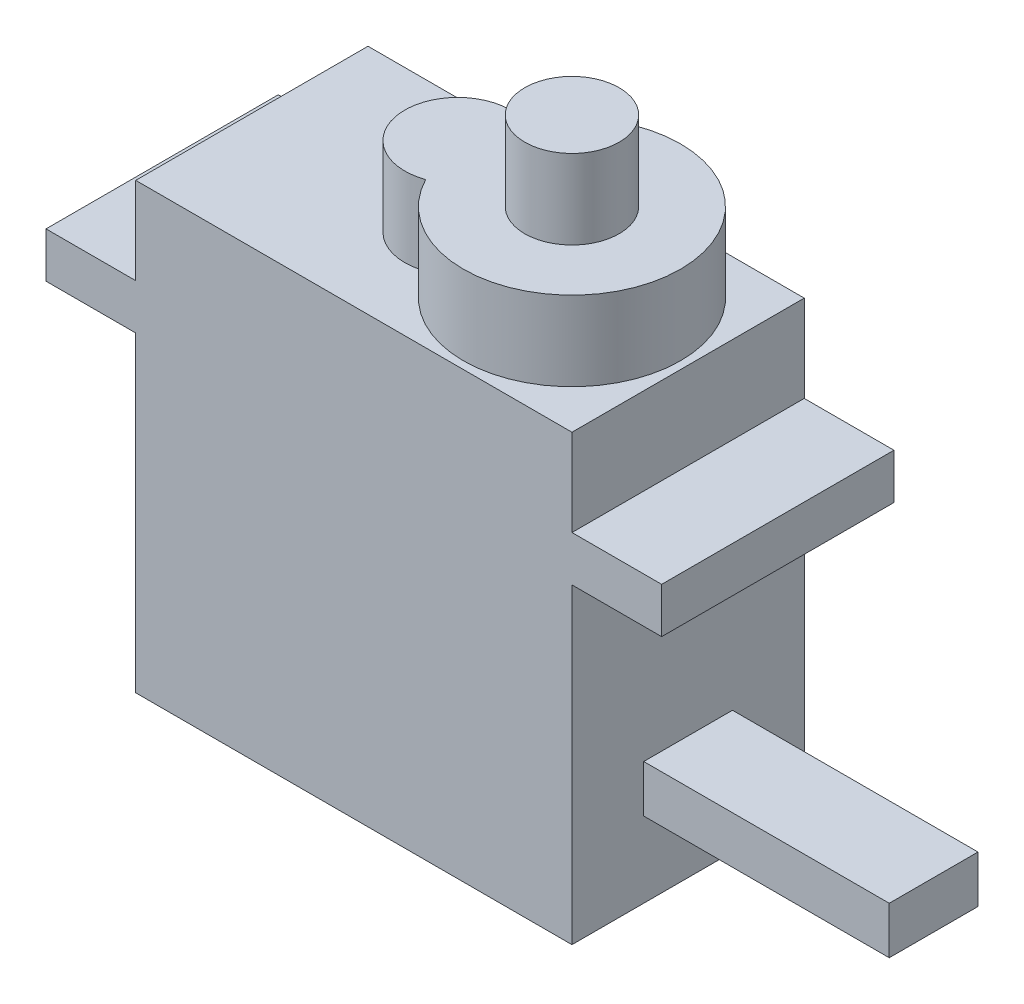
from build123d import *

# Parameters (mm, degrees)
SKETCH_1_W          = 23.1
SKETCH_1_H          = 4.6
SKETCH_1_H_2        = 2.4
SKETCH_1_W_2        = 4.75
SKETCH_1_H_3        = 16.5
EXTRUDE_1_DEPTH     = 12.3
SKETCH_2_R          = 5.75
SKETCH_2_R_2        = 2.8
EXTRUDE_3_DEPTH     = 4.2
SKETCH_4_R          = 2.5
EXTRUDE_4_DEPTH     = 4.2
SKETCH_5_W          = 4.7
SKETCH_5_H          = 2.5
EXTRUDE_5_DEPTH     = 8
SKETCH_6_W          = 4.7
SKETCH_6_H          = 2.5
EXTRUDE_6_DEPTH     = 5
SKETCH_7_R          = 0.965
CUT_EXTRUDE_1_DEPTH = 7


with BuildPart() as part:
    # 草图1 → 凸台-拉伸1 (new body)
    with BuildSketch(Plane.XY):
        with Locations((0, 9.45)):
            Rectangle(SKETCH_1_W, SKETCH_1_H)
        with Locations((0, 5.95)):
            Rectangle(SKETCH_1_W, SKETCH_1_H_2)
        with Locations((-13.925, 5.95)):
            Rectangle(SKETCH_1_W_2, SKETCH_1_H_2)
        with Locations((13.925, 5.95)):
            Rectangle(SKETCH_1_W_2, SKETCH_1_H_2)
        with Locations((0, -3.5)):
            Rectangle(SKETCH_1_W, SKETCH_1_H_3)
    extrude(amount=EXTRUDE_1_DEPTH)

    # 草图2 → 凸台-拉伸3 (add)
    with BuildSketch(Plane(origin=(0, 11.75, 0), x_dir=(1, 0, 0), z_dir=(0, 1, 0))):
        with Locations((5.4, -6.15)):
            Circle(SKETCH_2_R)
        with Locations((-0.65, -6.15)):
            Circle(SKETCH_2_R_2)
        with Locations((-0.65, -6.15)):
            Circle(SKETCH_2_R_2)
        with Locations((5.4, -6.15)):
            Circle(SKETCH_2_R)
        with Locations((5.4, -6.15)):
            Circle(SKETCH_2_R)
        with Locations((-0.65, -6.15)):
            Circle(SKETCH_2_R_2)
    extrude(amount=EXTRUDE_3_DEPTH)

    # 草图4 → 凸台-拉伸4 (add)
    with BuildSketch(Plane(origin=(0, 15.95, 0), x_dir=(1, 0, 0), z_dir=(0, 1, 0))):
        with Locations(Location((5.4, -6.15, 0), (0, 0, 270))):
            Circle(SKETCH_4_R)
    extrude(amount=EXTRUDE_4_DEPTH)

    # 草图5 → 凸台-拉伸5 (add)
    with BuildSketch(Plane(origin=(11.55, 0, 0), x_dir=(0, 0, -1), z_dir=(1, 0, 0))):
        with Locations((-6.15, -6.5)):
            Rectangle(SKETCH_5_W, SKETCH_5_H)
    extrude(amount=EXTRUDE_5_DEPTH)

    # 草图6 → 凸台-拉伸6 (add)
    with BuildSketch(Plane(origin=(19.55, 0, 0), x_dir=(0, 0, -1), z_dir=(1, 0, 0))):
        with Locations((-6.15, -6.5)):
            Rectangle(SKETCH_6_W, SKETCH_6_H)
    extrude(amount=EXTRUDE_6_DEPTH)

    # 草图7 → 切除-拉伸1 (cut)
    with BuildSketch(Plane(origin=(0, 7.15, 0), x_dir=(1, 0, 0), z_dir=(0, 1, 0))):
        with Locations(Location((-13.925, -6.15, 0), (0, 0, 180))):
            Circle(SKETCH_7_R)
    extrude(amount=-CUT_EXTRUDE_1_DEPTH, mode=Mode.SUBTRACT)


solid = part.part
